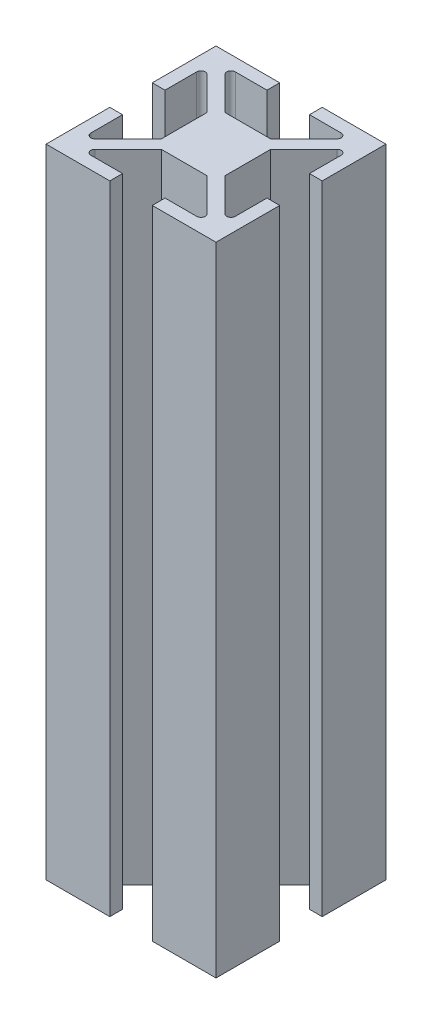
from build123d import *

# Parameters (mm, degrees)
BOSS_EXTRU_1_DEPTH = 75


with BuildPart() as part:
    # Esquisse1 → Boss.-Extru.1 (new body)
    with BuildSketch(Plane(origin=(0, 0, 0), x_dir=(1, 0, 0), z_dir=(0, 1, 0))):
        with BuildLine():
            Line((-10, -2.5), (-10, -10))
            Line((-10, -10), (-2.5, -10))
            Line((-2.5, -10), (-2.5, -8.5))
            Line((-2.5, -8.5), (-6.232233047, -8.5))
            ThreePointArc((-6.232233047, -8.5), (-6.694172813, -8.191341716), (-6.585786438, -7.646446609))
            Line((-6.585786438, -7.646446609), (-2.689339828, -3.75))
            Line((-2.689339828, -3.75), (2.689339828, -3.75))
            Line((2.689339828, -3.75), (6.585786438, -7.646446609))
            ThreePointArc((6.585786438, -7.646446609), (6.694172813, -8.191341716), (6.232233047, -8.5))
            Line((6.232233047, -8.5), (2.5, -8.5))
            Line((2.5, -8.5), (2.5, -10))
            Line((2.5, -10), (10, -10))
            Line((10, -10), (10, -2.5))
            Line((10, -2.5), (8.5, -2.5))
            Line((8.5, -2.5), (8.5, -6.232233047))
            ThreePointArc((8.5, -6.232233047), (8.191341716, -6.694172813), (7.646446609, -6.585786438))
            Line((7.646446609, -6.585786438), (3.75, -2.689339828))
            Line((3.75, -2.689339828), (3.75, 2.689339828))
            Line((3.75, 2.689339828), (7.646446609, 6.585786438))
            ThreePointArc((7.646446609, 6.585786438), (8.191341716, 6.694172813), (8.5, 6.232233047))
            Line((8.5, 6.232233047), (8.5, 2.5))
            Line((8.5, 2.5), (10, 2.5))
            Line((10, 2.5), (10, 10))
            Line((10, 10), (2.5, 10))
            Line((2.5, 10), (2.5, 8.5))
            Line((2.5, 8.5), (6.232233047, 8.5))
            ThreePointArc((6.232233047, 8.5), (6.694172813, 8.191341716), (6.585786438, 7.646446609))
            Line((6.585786438, 7.646446609), (2.689339828, 3.75))
            Line((2.689339828, 3.75), (-2.689339828, 3.75))
            Line((-2.689339828, 3.75), (-6.585786438, 7.646446609))
            ThreePointArc((-6.585786438, 7.646446609), (-6.694172813, 8.191341716), (-6.232233047, 8.5))
            Line((-6.232233047, 8.5), (-2.5, 8.5))
            Line((-2.5, 8.5), (-2.5, 10))
            Line((-2.5, 10), (-10, 10))
            Line((-10, 10), (-10, 2.5))
            Line((-10, 2.5), (-8.5, 2.5))
            Line((-8.5, 2.5), (-8.5, 6.232233047))
            ThreePointArc((-8.5, 6.232233047), (-8.191341716, 6.694172813), (-7.646446609, 6.585786438))
            Line((-7.646446609, 6.585786438), (-3.75, 2.689339828))
            Line((-3.75, 2.689339828), (-3.75, -2.689339828))
            Line((-3.75, -2.689339828), (-7.646446609, -6.585786438))
            ThreePointArc((-7.646446609, -6.585786438), (-8.191341716, -6.694172813), (-8.5, -6.232233047))
            Line((-8.5, -6.232233047), (-8.5, -2.5))
            Line((-8.5, -2.5), (-10, -2.5))
        make_face()
    extrude(amount=BOSS_EXTRU_1_DEPTH)


solid = part.part
